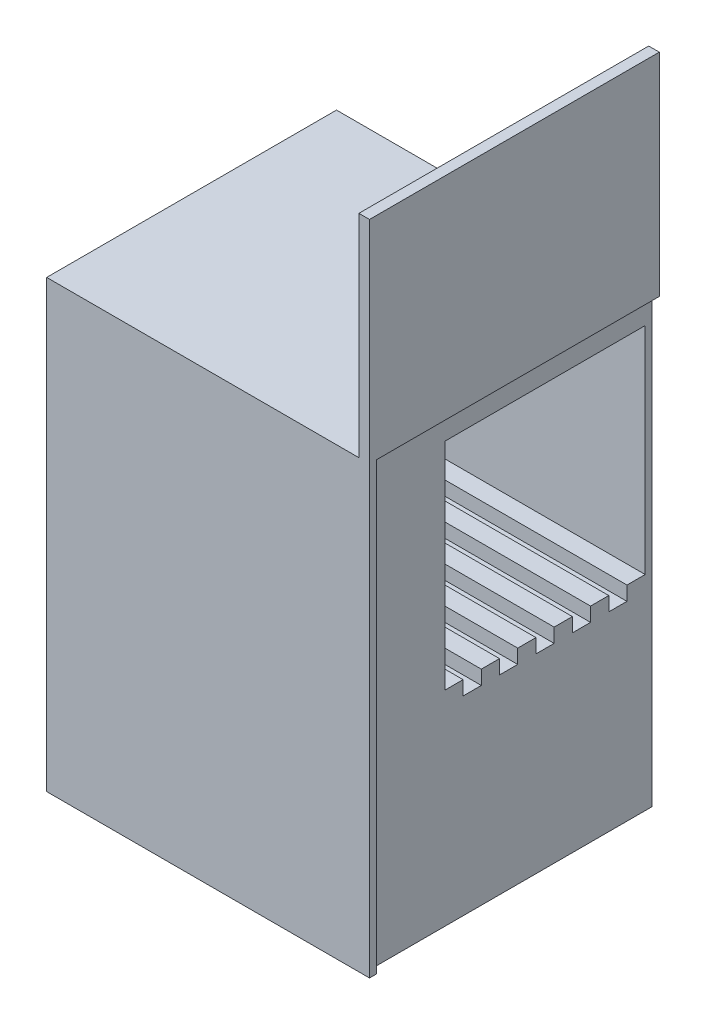
from build123d import *

# Parameters (mm, degrees)
SKETCH_1_W             = 268
SKETCH_1_H             = 378
EXTRUDE_1_DEPTH        = 246
SKETCH_2_W             = 170
SKETCH_2_H             = 183
CUT_EXTRUDE_1_DEPTH    = 256
EXTRUDE_4_DEPTH        = 6
EXTRUDE_4_DEPTH_BACK   = 3
SKETCH_8_W             = 15.454545454
SKETCH_8_H             = 12
CUT_EXTRUDE_2_DEPTH    = 262
PATTERN_LINEAR_1_COUNT = 5
PATTERN_LINEAR_1_PITCH = 30.909090909


with BuildPart() as part:
    # Эскиз1 → Бобышка-Вытянуть1 (new body)
    with BuildSketch(Plane.XY):
        with Locations((484.747616564, 117.897162102)):
            Rectangle(SKETCH_1_W, SKETCH_1_H)
    extrude(amount=EXTRUDE_1_DEPTH)

    # Эскиз2 → Вырез-Вытянуть1 (cut)
    with BuildSketch(Plane(origin=(618.747616564, 0, 0), x_dir=(0, 0, -1), z_dir=(1, 0, 0))):
        with Locations((-91, 193.997162102)):
            Rectangle(SKETCH_2_W, SKETCH_2_H)
    extrude(amount=-CUT_EXTRUDE_1_DEPTH, mode=Mode.SUBTRACT)

    # Эскиз7 → Бобышка-Вытянуть4 (add, two sides: drawn at the far end of the back side and taken through both)
    with BuildSketch(Plane(origin=(618.747616564, 0, 0), x_dir=(0, 0, -1), z_dir=(1, 0, 0)).offset(-EXTRUDE_4_DEPTH_BACK)):
        Polygon((-240, -71.102837898), (-246, -71.102837898), (-246, 486.497162102), (0, 486.497162102), (0, 306.897162102), (-240, 306.897162102), align=None)
    extrude(amount=EXTRUDE_4_DEPTH + EXTRUDE_4_DEPTH_BACK)

    # Эскиз8 → Вырез-Вытянуть2 (cut)
    with BuildSketch(Plane(origin=(618.747616564, 0, 0), x_dir=(0, 0, -1), z_dir=(1, 0, 0))):
        with Locations((-152.818181818, 96.497162102)):
            Rectangle(SKETCH_8_W, SKETCH_8_H)
    cut_extrude_2 = extrude(amount=-CUT_EXTRUDE_2_DEPTH, mode=Mode.SUBTRACT)

    # Линейный массив1: Вырез-Вытянуть2 ×5
    with Locations(*[(0, 0, -i * PATTERN_LINEAR_1_PITCH) for i in range(1, PATTERN_LINEAR_1_COUNT)]):
        add(cut_extrude_2, mode=Mode.SUBTRACT)


solid = part.part
